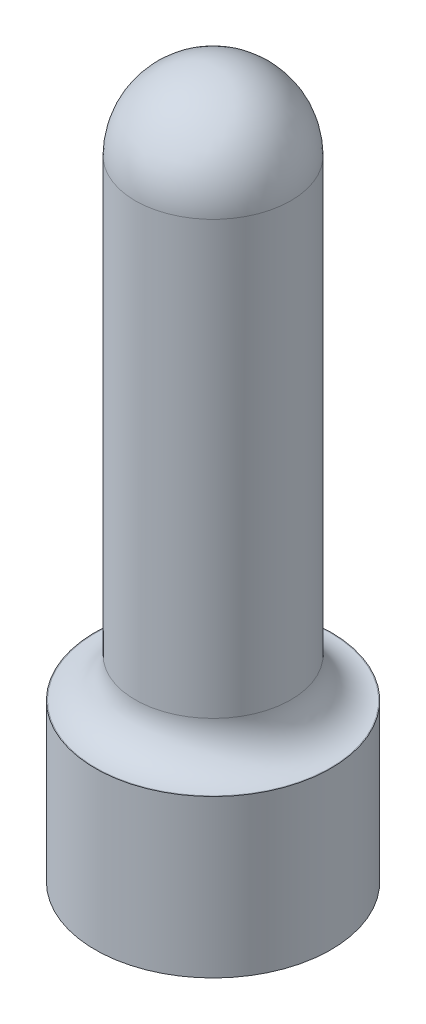
from build123d import *

# Parameters (mm, degrees)
ESBO_O1_R                = 9.9
RESSALTO_EXTRUS_O1_DEPTH = 80
ESBO_O4_R                = 15
RESSALTO_EXTRUS_O2_DEPTH = 20
FILETE3_R                = 5


with BuildPart() as part:
    # Esboço1 → Ressalto-extrusão1 (new body)
    with BuildSketch(Plane(origin=(0, 0, 0), x_dir=(1, 0, 0), z_dir=(0, 1, 0))):
        with Locations(Location((0, 0, 0), (0, 0, 270))):
            Circle(ESBO_O1_R)
    extrude(amount=RESSALTO_EXTRUS_O1_DEPTH)

    # Esboço3 → Revolução1 (revolve)
    with BuildSketch(Plane.XY):
        with BuildLine():
            Line((-9.9, 80), (9.9, 80))
            ThreePointArc((9.9, 80), (0, 89.9), (-9.9, 80))
        make_face()
    revolve(axis=Axis((-9.9, 80, 0), (1, 0, 0)))

    # Esboço4 → Ressalto-extrusão2 (add)
    with BuildSketch(Plane.XZ):
        with Locations(Location((0, 0, 0), (0, 0, 270))):
            Circle(ESBO_O4_R)
    extrude(amount=-RESSALTO_EXTRUS_O2_DEPTH)

    # Filete3
    filete3_edges = [part.edges().sort_by_distance(p)[0] for p in [
        (0, 20, -9.9),
    ]]
    fillet(filete3_edges, radius=FILETE3_R)


solid = part.part
